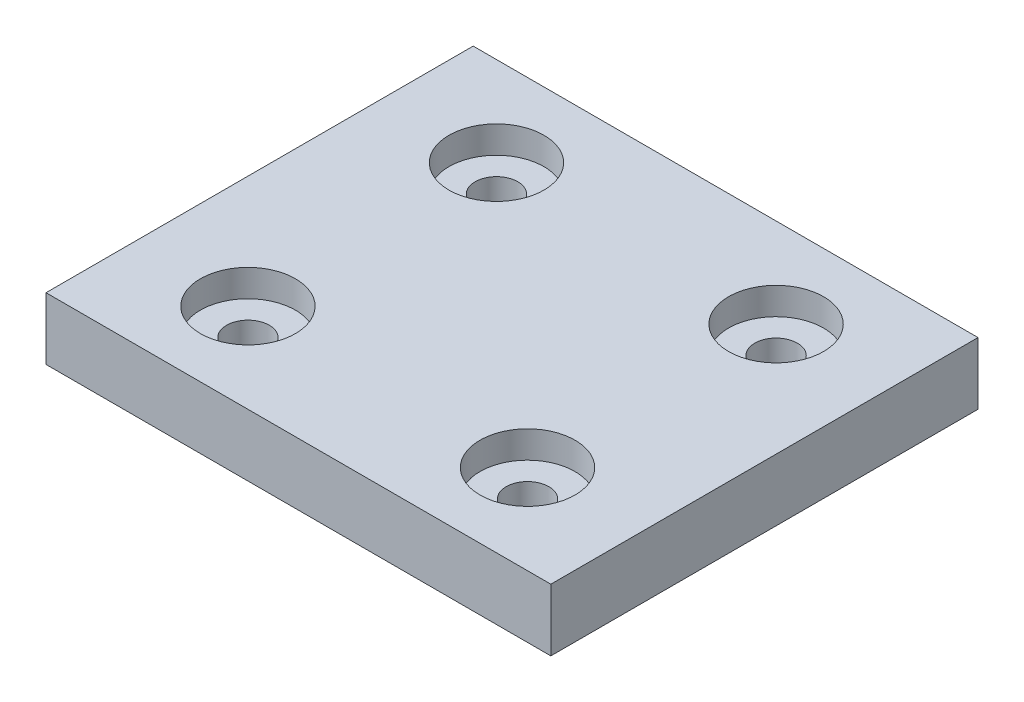
from build123d import *

# Parameters (mm, degrees)
SKETCH1_W                                    = 65
SKETCH1_H                                    = 55
BOSS_EXTRUDE1_DEPTH                          = 8
CBORE_FOR_M5_HEX_HEAD_CAP_SCREW1_D           = 5.5
CBORE_FOR_M5_HEX_HEAD_CAP_SCREW1_CBORE_D     = 12.238
CBORE_FOR_M5_HEX_HEAD_CAP_SCREW1_CBORE_DEPTH = 3.5


with BuildPart() as part:
    # Sketch1 → Boss-Extrude1 (new body)
    with BuildSketch(Plane(origin=(0, 0, 0), x_dir=(1, 0, 0), z_dir=(0, 1, 0))):
        Rectangle(SKETCH1_W, SKETCH1_H)
    extrude(amount=BOSS_EXTRUDE1_DEPTH)

    # CBORE for M5 Hex Head Cap Screw1 (through all)
    with Locations(Plane(origin=(0, 8, 0), x_dir=(1, 0, 0), z_dir=(0, 1, 0))):
        with Locations((-18, 16), (18, 16), (18, -16), (-18, -16)):
            CounterBoreHole(CBORE_FOR_M5_HEX_HEAD_CAP_SCREW1_D / 2, CBORE_FOR_M5_HEX_HEAD_CAP_SCREW1_CBORE_D / 2, CBORE_FOR_M5_HEX_HEAD_CAP_SCREW1_CBORE_DEPTH)


solid = part.part
